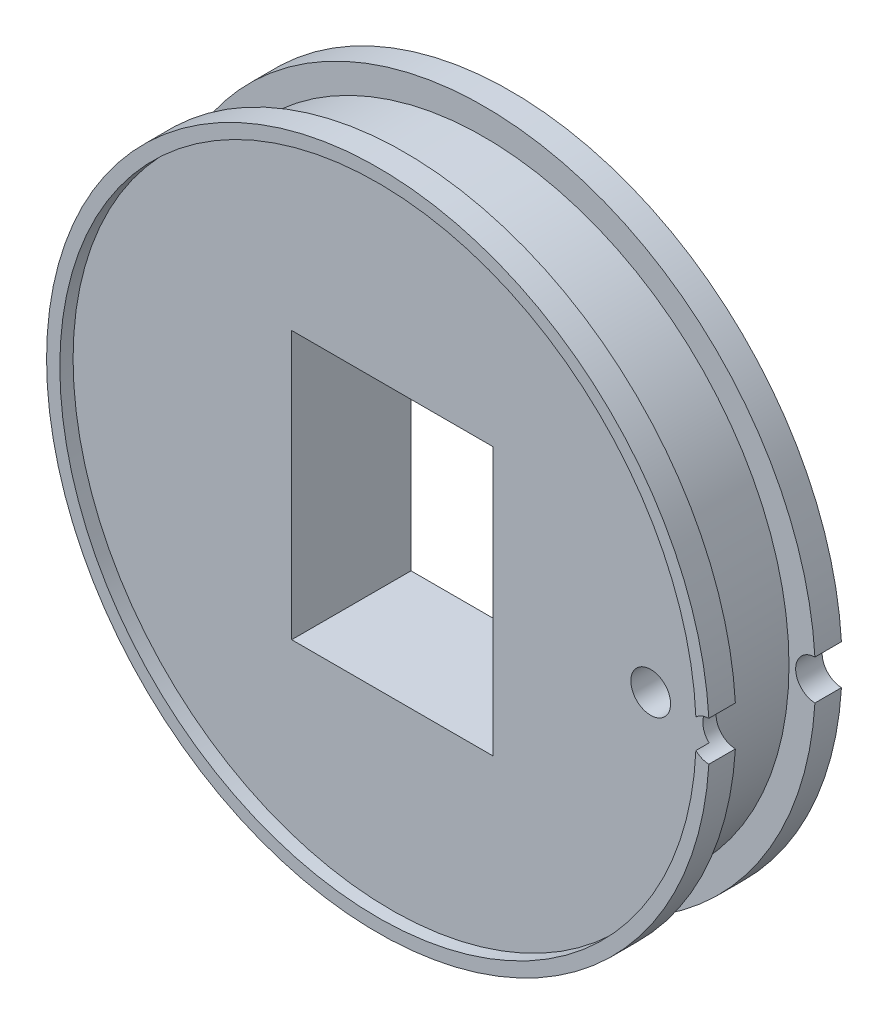
from build123d import *

# Parameters (mm, degrees)
SKIZZE1_R                       = 25
AUFSATZ_LINEAR_AUSTRAGEN1_DEPTH = 9
SKIZZE3_R                       = 25
SKIZZE3_R_2                     = 24
AUFSATZ_LINEAR_AUSTRAGEN2_DEPTH = 1
SCHNITT_LINEAR_AUSTRAGEN1_REACH = 38.483
SKIZZE4_W                       = 15.2
SKIZZE4_H                       = 20.2
SKIZZE6_R                       = 25
SKIZZE6_R_2                     = 23
SCHNITT_LINEAR_AUSTRAGEN2_DEPTH = 6
SKIZZE7_R                       = 1.5
SCHNITT_LINEAR_AUSTRAGEN3_DEPTH = 37.742346142
SKIZZE8_R                       = 1.5
SCHNITT_LINEAR_AUSTRAGEN4_DEPTH = 37.742346142


with BuildPart() as part:
    # Skizze1 → Aufsatz-Linear austragen1 (new body)
    with BuildSketch(Plane.XY):
        Circle(SKIZZE1_R)
    extrude(amount=AUFSATZ_LINEAR_AUSTRAGEN1_DEPTH)

    # Skizze3 → Aufsatz-Linear austragen2 (add)
    with BuildSketch(Plane.XY.offset(9)):
        Circle(SKIZZE3_R)
        Circle(SKIZZE3_R_2, mode=Mode.SUBTRACT)
    extrude(amount=AUFSATZ_LINEAR_AUSTRAGEN2_DEPTH)

    # Skizze4 → Schnitt-Linear austragen1 (cut, up to next)
    with BuildSketch(Plane.XY.offset(9), mode=Mode.PRIVATE) as schnitt_linear_austragen1_sk1:
        with Locations((0.09, 0)):
            Rectangle(SKIZZE4_W, SKIZZE4_H)
    schnitt_linear_austragen1_tool1 = extrude(schnitt_linear_austragen1_sk1.sketch, amount=-SCHNITT_LINEAR_AUSTRAGEN1_REACH, mode=Mode.PRIVATE) & part.part
    add(schnitt_linear_austragen1_tool1.solids().sort_by_distance((0.09, 0, 9))[0], mode=Mode.SUBTRACT)

    # Skizze6 → Schnitt-Linear austragen2 (cut)
    with BuildSketch(Plane(origin=(0, 0, 2), x_dir=(-1, 0, 0), z_dir=(0, 0, -1))):
        Circle(SKIZZE6_R)
        Circle(SKIZZE6_R_2, mode=Mode.SUBTRACT)
    extrude(amount=-SCHNITT_LINEAR_AUSTRAGEN2_DEPTH, mode=Mode.SUBTRACT)

    # Skizze7 → Schnitt-Linear austragen3 (cut, through all)
    with BuildSketch(Plane(origin=(0, 0, 0), x_dir=(-1, 0, 0), z_dir=(0, 0, -1))):
        with Locations((-19.569472829, 0)):
            Circle(SKIZZE7_R)
    extrude(amount=-SCHNITT_LINEAR_AUSTRAGEN3_DEPTH, mode=Mode.SUBTRACT)

    # Skizze8 → Schnitt-Linear austragen4 (cut, through all)
    with BuildSketch(Plane(origin=(0, 0, 0), x_dir=(-1, 0, 0), z_dir=(0, 0, -1))):
        with Locations((-25, 0)):
            Circle(SKIZZE8_R)
    extrude(amount=-SCHNITT_LINEAR_AUSTRAGEN4_DEPTH, mode=Mode.SUBTRACT)


solid = part.part
